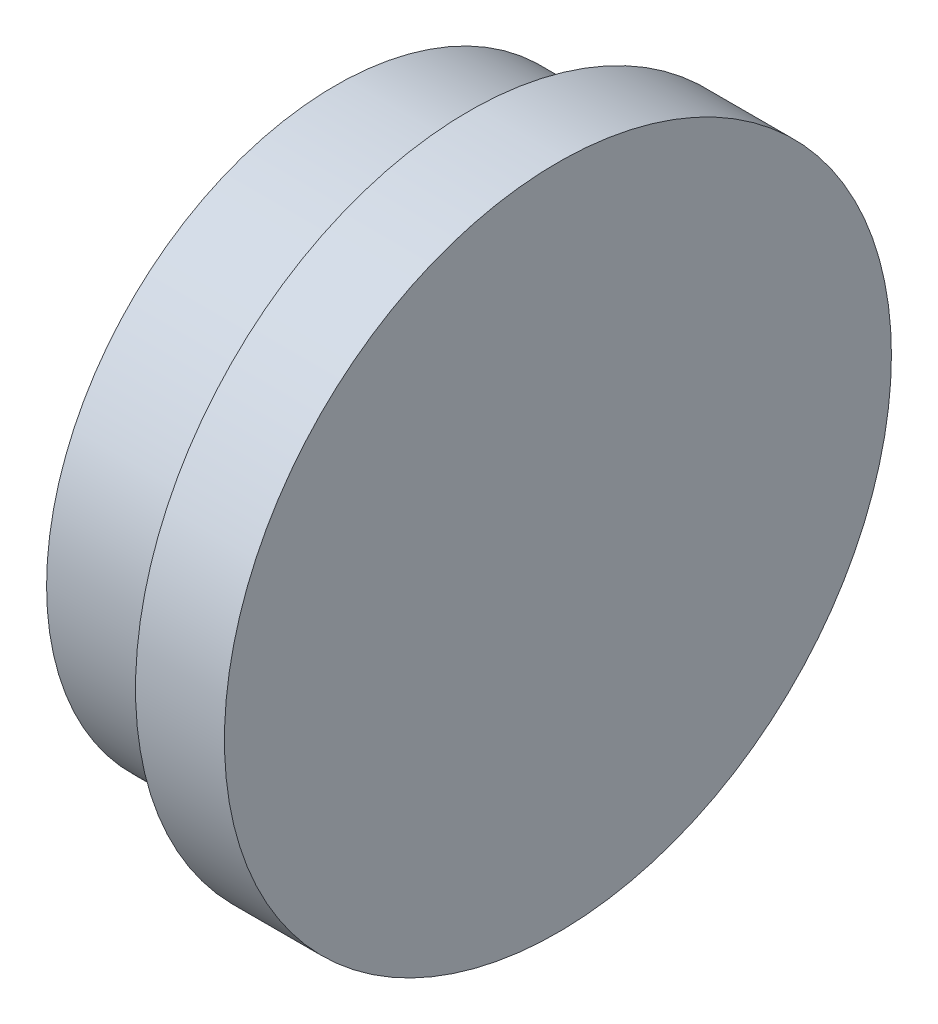
from build123d import *

# Parameters (mm, degrees)
SKETCH_1_R      = 16.51
EXTRUDE_1_DEPTH = 7.62
SKETCH_2_R      = 19.05
EXTRUDE_2_DEPTH = 5.08


with BuildPart() as part:
    # 草图1 → 凸台-拉伸1 (new body)
    with BuildSketch(Plane(origin=(0, 0, 0), x_dir=(0, 0, -1), z_dir=(1, 0, 0))):
        Circle(SKETCH_1_R)
    extrude(amount=EXTRUDE_1_DEPTH)

    # 草图2 → 凸台-拉伸2 (add)
    with BuildSketch(Plane(origin=(7.62, 0, 0), x_dir=(0, 0, -1), z_dir=(1, 0, 0))):
        Circle(SKETCH_2_R)
    extrude(amount=EXTRUDE_2_DEPTH)


solid = part.part
